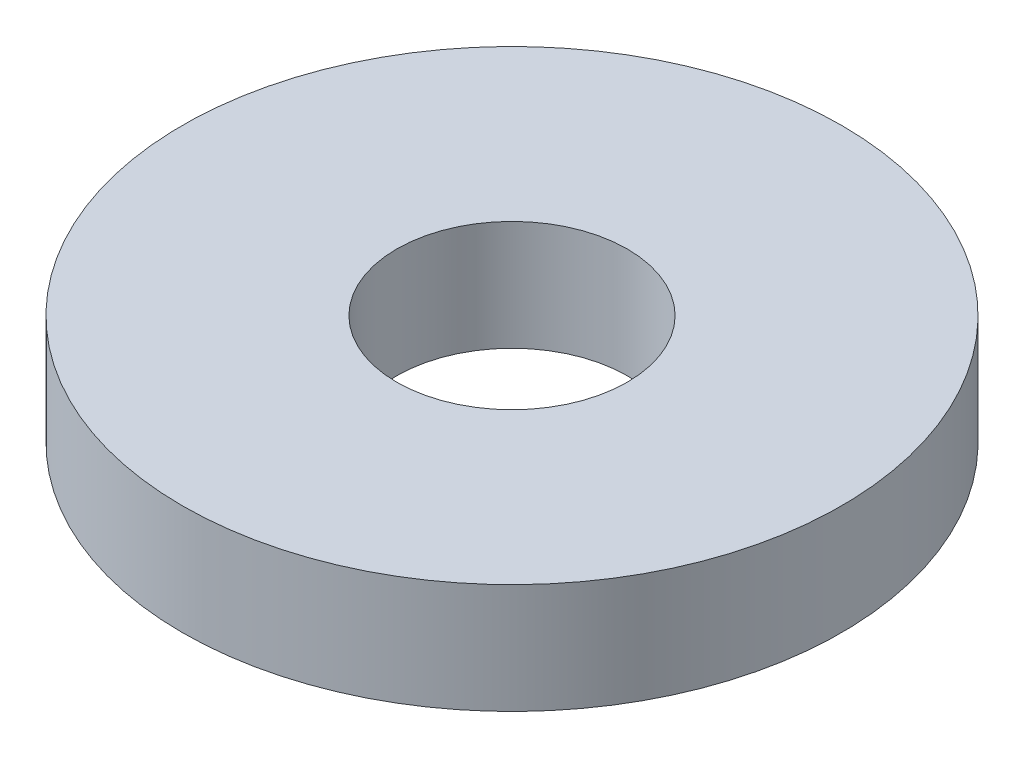
from build123d import *

# Parameters (mm, degrees)
SKETCH_1_R      = 6
SKETCH_1_R_2    = 2.1
EXTRUDE_1_DEPTH = 2


with BuildPart() as part:
    # Эскиз1 → Бобышка-Вытянуть1 (new body)
    with BuildSketch(Plane(origin=(0, 0, 0), x_dir=(1, 0, 0), z_dir=(0, 1, 0))):
        with Locations(Location((0, 0, 0), (0, 0, 270))):
            Circle(SKETCH_1_R)
        with Locations(Location((0, 0, 0), (0, 0, 270))):
            Circle(SKETCH_1_R_2, mode=Mode.SUBTRACT)
    extrude(amount=EXTRUDE_1_DEPTH)


solid = part.part
